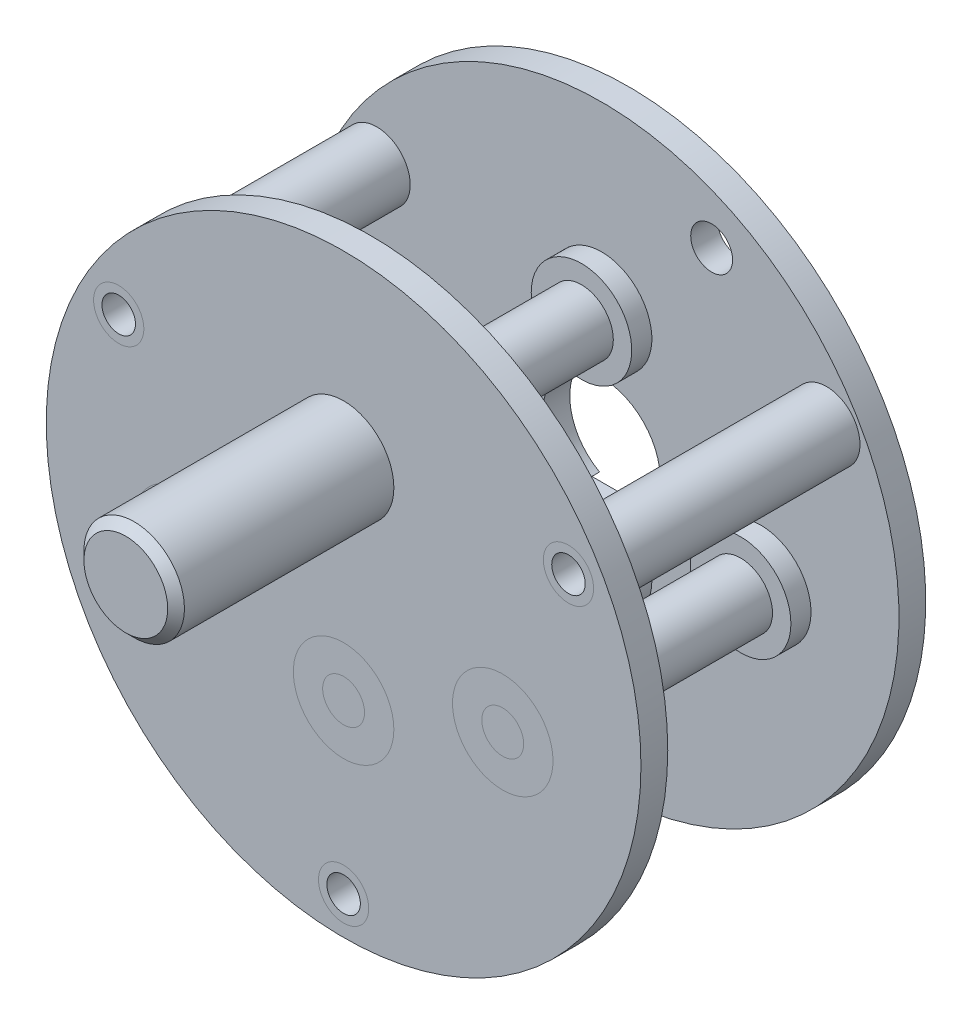
from build123d import *

# Parameters (mm, degrees)
SKETCH_1_R          = 17.75
EXTRUDE_1_DEPTH     = 1.6
SKETCH_2_R          = 2
EXTRUDE_2_DEPTH     = 13.8
EXTRUDE_START       = 1.6
SKETCH_3_R          = 17.75
EXTRUDE_3_DEPTH     = 1.6
CUT_EXTRUDE_2_REACH = 32.317
SKETCH_5_R          = 3.5
SKETCH_5_R_2        = 1
SKETCH_6_R          = 6
EXTRUDE_4_DEPTH     = 10
SKETCH_7_R          = 3
EXTRUDE_5_DEPTH     = 15
CHAMFER_1_SIZE      = 0.5
CUT_EXTRUDE_START   = -12
CUT_EXTRUDE_3_DEPTH = 12
SKETCH_10_R         = 3
EXTRUDE_6_DEPTH     = 2.8
EXTRUDE_7_REACH     = 39.456
SKETCH_13_R         = 1.9
CUT_EXTRUDE_4_REACH = 50.93
CUT_EXTRUDE_5_REACH = 50.93
SKETCH_17_R         = 1.25
CHAMFER_2_SIZE      = 0.5
EXTRUDE_START_2     = 1.2
SKETCH_19_R         = 3
EXTRUDE_8_DEPTH     = 1.2
EXTRUDE_9_REACH     = 39.456
SKETCH_20_R         = 1.9
SKETCH_21_R         = 3
EXTRUDE_10_DEPTH    = 1.2
CUT_EXTRUDE_START_2 = -10
SKETCH_23_R         = 6
SKETCH_23_R_2       = 3
CUT_EXTRUDE_7_DEPTH = 10
SKETCH_24_R         = 3
CUT_EXTRUDE_8_DEPTH = 12
CHAMFER_3_SIZE      = 0.5


with BuildPart() as part:
    # ｽｹｯﾁ1 → ﾎﾞｽ - 押し出し1 (new body)
    with BuildSketch(Plane.XY):
        Circle(SKETCH_1_R)
    extrude(amount=EXTRUDE_1_DEPTH)

    # ｽｹｯﾁ2 → ﾎﾞｽ - 押し出し2 (add)
    with BuildSketch(Plane(origin=(0, 0, 0), x_dir=(-1, 0, 0), z_dir=(0, 0, -1))):
        with Locations(Location((0, -15.5, 0), (0, 0, 180))):
            Circle(SKETCH_2_R)
        with Locations(Location((-13.423393759, 7.75, 0), (0, 0, 180))):
            Circle(SKETCH_2_R)
        with Locations(Location((13.423393759, 7.75, 0), (0, 0, 180))):
            Circle(SKETCH_2_R)
    extrude(amount=EXTRUDE_2_DEPTH)

    # ｽｹｯﾁ3 → ﾎﾞｽ - 押し出し3 (add)
    with BuildSketch(Plane(origin=(0, 0, -13.8), x_dir=(-1, 0, 0), z_dir=(0, 0, -1)).offset(EXTRUDE_START)):
        with Locations(Location((0, 0, 0), (0, 0, 180))):
            Circle(SKETCH_3_R)
    extrude(amount=-EXTRUDE_3_DEPTH)

    # ｽｹｯﾁ5 → ｶｯﾄ - 押し出し2 (cut, up to next)
    with BuildSketch(Plane(origin=(0, 0, -15.4), x_dir=(-1, 0, 0), z_dir=(0, 0, -1)), mode=Mode.PRIVATE) as cut_extrude_2_sk1:
        Circle(SKETCH_5_R)
    cut_extrude_2_tool1 = extrude(cut_extrude_2_sk1.sketch, amount=-CUT_EXTRUDE_2_REACH, mode=Mode.PRIVATE) & part.part
    # ｽｹｯﾁ5 → ｶｯﾄ - 押し出し2 (cut, up to next)
    with BuildSketch(Plane(origin=(0, 0, -15.4), x_dir=(-1, 0, 0), z_dir=(0, 0, -1)), mode=Mode.PRIVATE) as cut_extrude_2_sk2:
        with Locations((-13.423393759, 7.75)):
            Circle(SKETCH_5_R_2)
    cut_extrude_2_tool2 = extrude(cut_extrude_2_sk2.sketch, amount=-CUT_EXTRUDE_2_REACH, mode=Mode.PRIVATE) & part.part
    # ｽｹｯﾁ5 → ｶｯﾄ - 押し出し2 (cut, up to next)
    with BuildSketch(Plane(origin=(0, 0, -15.4), x_dir=(-1, 0, 0), z_dir=(0, 0, -1)), mode=Mode.PRIVATE) as cut_extrude_2_sk3:
        with Locations((13.423393759, 7.75)):
            Circle(SKETCH_5_R_2)
    cut_extrude_2_tool3 = extrude(cut_extrude_2_sk3.sketch, amount=-CUT_EXTRUDE_2_REACH, mode=Mode.PRIVATE) & part.part
    # ｽｹｯﾁ5 → ｶｯﾄ - 押し出し2 (cut, up to next)
    with BuildSketch(Plane(origin=(0, 0, -15.4), x_dir=(-1, 0, 0), z_dir=(0, 0, -1)), mode=Mode.PRIVATE) as cut_extrude_2_sk4:
        with Locations((0, -15.5)):
            Circle(SKETCH_5_R_2)
    cut_extrude_2_tool4 = extrude(cut_extrude_2_sk4.sketch, amount=-CUT_EXTRUDE_2_REACH, mode=Mode.PRIVATE) & part.part
    add(cut_extrude_2_tool1.solids().sort_by_distance((0, 0, -15.4))[0], mode=Mode.SUBTRACT)
    add(cut_extrude_2_tool2.solids().sort_by_distance((13.423394, 7.75, -15.4))[0], mode=Mode.SUBTRACT)
    add(cut_extrude_2_tool3.solids().sort_by_distance((-13.423394, 7.75, -15.4))[0], mode=Mode.SUBTRACT)
    add(cut_extrude_2_tool4.solids().sort_by_distance((0, -15.5, -15.4))[0], mode=Mode.SUBTRACT)

    # ｽｹｯﾁ6 → ﾎﾞｽ - 押し出し4 (add)
    with BuildSketch(Plane.XY.offset(1.6)):
        with Locations((0, 7)):
            Circle(SKETCH_6_R)
    extrude(amount=EXTRUDE_4_DEPTH)

    # ｽｹｯﾁ7 → ﾎﾞｽ - 押し出し5 (add)
    with BuildSketch(Plane.XY.offset(11.6)):
        with Locations((0, 7)):
            Circle(SKETCH_7_R)
    extrude(amount=EXTRUDE_5_DEPTH)

    # 面取り1
    chamfer_1_edges = [part.edges().sort_by_distance(p)[0] for p in [
        (-3, 7, 26.6),
    ]]
    chamfer(chamfer_1_edges, length=CHAMFER_1_SIZE)

    # ｽｹｯﾁ8 → ｶｯﾄ - 押し出し3 (cut)
    with BuildSketch(Plane.XY.offset(26.6).offset(CUT_EXTRUDE_START)):
        with BuildLine():
            Line((1.658312395, 9.5), (-1.658312395, 9.5))
            ThreePointArc((-1.658312395, 9.5), (0, 10), (1.658312395, 9.5))
        make_face()
    extrude(amount=CUT_EXTRUDE_3_DEPTH, mode=Mode.SUBTRACT)

    # ｽｹｯﾁ10 → ﾎﾞｽ - 押し出し6 (add)
    with BuildSketch(Plane.XY.offset(1.6)):
        with Locations((0, -5.5)):
            Circle(SKETCH_10_R)
        with Locations((9.5, -2.377501001)):
            Circle(SKETCH_10_R)
        with Locations((-9.5, -2.377501001)):
            Circle(SKETCH_10_R)
    extrude_6 = extrude(amount=-EXTRUDE_6_DEPTH)

    # ﾐﾗｰ1: ﾎﾞｽ - 押し出し6 across plane
    add(extrude_6.mirror(Plane.XY.offset(-6.9)))

    # ｽｹｯﾁ13 → ﾎﾞｽ - 押し出し7 (add, up to next)
    with BuildSketch(Plane(origin=(0, 0, -1.2), x_dir=(-1, 0, 0), z_dir=(0, 0, -1)), mode=Mode.PRIVATE) as extrude_7_sk1:
        with Locations(Location((-9.5, -2.377501001, 0), (0, 0, 180))):
            Circle(SKETCH_13_R)
    extrude_7_tool1 = extrude(extrude_7_sk1.sketch, amount=EXTRUDE_7_REACH, mode=Mode.PRIVATE) - part.part
    # ｽｹｯﾁ13 → ﾎﾞｽ - 押し出し7 (add, up to next)
    with BuildSketch(Plane(origin=(0, 0, -1.2), x_dir=(-1, 0, 0), z_dir=(0, 0, -1)), mode=Mode.PRIVATE) as extrude_7_sk2:
        with Locations(Location((0, -5.5, 0), (0, 0, 180))):
            Circle(SKETCH_13_R)
    extrude_7_tool2 = extrude(extrude_7_sk2.sketch, amount=EXTRUDE_7_REACH, mode=Mode.PRIVATE) - part.part
    # ｽｹｯﾁ13 → ﾎﾞｽ - 押し出し7 (add, up to next)
    with BuildSketch(Plane(origin=(0, 0, -1.2), x_dir=(-1, 0, 0), z_dir=(0, 0, -1)), mode=Mode.PRIVATE) as extrude_7_sk3:
        with Locations(Location((9.5, -2.377501001, 0), (0, 0, 180))):
            Circle(SKETCH_13_R)
    extrude_7_tool3 = extrude(extrude_7_sk3.sketch, amount=EXTRUDE_7_REACH, mode=Mode.PRIVATE) - part.part
    add(extrude_7_tool1.solids().sort_by_distance((9.5, -2.377501, -1.2))[0])
    add(extrude_7_tool2.solids().sort_by_distance((0, -5.5, -1.2))[0])
    add(extrude_7_tool3.solids().sort_by_distance((-9.5, -2.377501, -1.2))[0])

    # ｽｹｯﾁ15 → ｶｯﾄ - 押し出し4 (cut, up to next)
    with BuildSketch(Plane(origin=(0, 0, -15.4), x_dir=(-1, 0, 0), z_dir=(0, 0, -1)), mode=Mode.PRIVATE) as cut_extrude_4_sk1:
        with BuildLine():
            Line((2.236067977, -3.5), (-2.236067977, -3.5))
            ThreePointArc((-2.236067977, -3.5), (-1.99347124, -3.258109634), (-1.724878724, -3.045454545))
            ThreePointArc((-1.724878724, -3.045454545), (0, -2.5), (1.724878724, -3.045454545))
            ThreePointArc((1.724878724, -3.045454545), (1.99347124, -3.258109634), (2.236067977, -3.5))
        make_face()
    cut_extrude_4_tool1 = extrude(cut_extrude_4_sk1.sketch, amount=-CUT_EXTRUDE_4_REACH, mode=Mode.PRIVATE) & part.part
    add(cut_extrude_4_tool1.solids().sort_by_distance((0, -3.093671, -15.4))[0], mode=Mode.SUBTRACT)

    # ｽｹｯﾁ17 → ｶｯﾄ - 押し出し5 (cut, up to next)
    with BuildSketch(Plane(origin=(0, 0, -15.4), x_dir=(-1, 0, 0), z_dir=(0, 0, -1)), mode=Mode.PRIVATE) as cut_extrude_5_sk1:
        with Locations((-6.569553896, 13.48484192)):
            Circle(SKETCH_17_R)
    cut_extrude_5_tool1 = extrude(cut_extrude_5_sk1.sketch, amount=-CUT_EXTRUDE_5_REACH, mode=Mode.PRIVATE) & part.part
    # ｽｹｯﾁ17 → ｶｯﾄ - 押し出し5 (cut, up to next)
    with BuildSketch(Plane(origin=(0, 0, -15.4), x_dir=(-1, 0, 0), z_dir=(0, 0, -1)), mode=Mode.PRIVATE) as cut_extrude_5_sk2:
        with Locations((6.569553896, -13.48484192)):
            Circle(SKETCH_17_R)
    cut_extrude_5_tool2 = extrude(cut_extrude_5_sk2.sketch, amount=-CUT_EXTRUDE_5_REACH, mode=Mode.PRIVATE) & part.part
    add(cut_extrude_5_tool1.solids().sort_by_distance((6.569554, 13.484842, -15.4))[0], mode=Mode.SUBTRACT)
    add(cut_extrude_5_tool2.solids().sort_by_distance((-6.569554, -13.484842, -15.4))[0], mode=Mode.SUBTRACT)

    # 面取り2
    chamfer_2_edges = [part.edges().sort_by_distance(p)[0] for p in [
        (-6, 7, 11.6),
    ]]
    chamfer(chamfer_2_edges, length=CHAMFER_2_SIZE)

    # ｽｹｯﾁ19 → ﾎﾞｽ - 押し出し8 (add)
    with BuildSketch(Plane(origin=(0, 0, 0), x_dir=(-1, 0, 0), z_dir=(0, 0, -1)).offset(EXTRUDE_START_2)):
        with Locations(Location((0, 7, 0), (0, 0, 56.442690238))):
            Circle(SKETCH_19_R)
    extrude(amount=-EXTRUDE_8_DEPTH)

    # ｽｹｯﾁ20 → ﾎﾞｽ - 押し出し9 (add, up to next)
    with BuildSketch(Plane(origin=(0, 0, -1.2), x_dir=(-1, 0, 0), z_dir=(0, 0, -1)), mode=Mode.PRIVATE) as extrude_9_sk1:
        with Locations(Location((0, 7, 0), (0, 0, 180))):
            Circle(SKETCH_20_R)
    extrude_9_tool1 = extrude(extrude_9_sk1.sketch, amount=EXTRUDE_9_REACH, mode=Mode.PRIVATE) - part.part
    add(extrude_9_tool1.solids().sort_by_distance((0, 7, -1.2))[0])

    # ｽｹｯﾁ21 → ﾎﾞｽ - 押し出し10 (add)
    with BuildSketch(Plane.XY.offset(-13.8)):
        with Locations(Location((0, 7, 0), (0, 0, 123.557309762))):
            Circle(SKETCH_21_R)
    extrude(amount=EXTRUDE_10_DEPTH)

    # ｽｹｯﾁ23 → ｶｯﾄ - 押し出し7 (cut)
    with BuildSketch(Plane.XY.offset(11.6).offset(CUT_EXTRUDE_START_2)):
        with Locations((0, 7)):
            Circle(SKETCH_23_R)
        with Locations((0, 7)):
            Circle(SKETCH_23_R_2, mode=Mode.SUBTRACT)
    extrude(amount=CUT_EXTRUDE_7_DEPTH, mode=Mode.SUBTRACT)

    # ｽｹｯﾁ24 → ｶｯﾄ - 押し出し8 (cut)
    with BuildSketch(Plane.XY.offset(26.6).offset(CUT_EXTRUDE_START)):
        with Locations((0, 7)):
            Circle(SKETCH_24_R)
    extrude(amount=CUT_EXTRUDE_8_DEPTH, mode=Mode.SUBTRACT)

    # 面取り3
    chamfer_3_edges = [part.edges().sort_by_distance(p)[0] for p in [
        (-3, 7, 14.6),
    ]]
    chamfer(chamfer_3_edges, length=CHAMFER_3_SIZE)


solid = part.part
